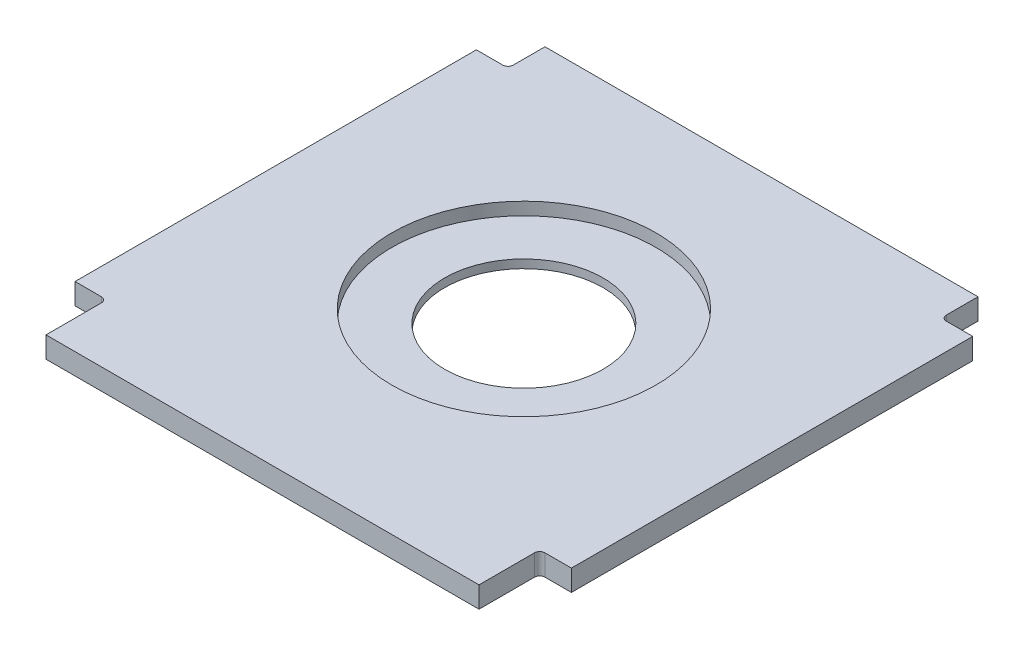
from build123d import *

# Parameters (mm, degrees)
BOSS_EXTRUDE1_DEPTH = 4
CUT_EXTRUDE1_REACH  = 70.376
SKETCH2_R           = 15
FILLET1_R           = 1
SKETCH4_R           = 25
SKETCH4_R_2         = 15
CUT_EXTRUDE2_DEPTH  = 2.4


with BuildPart() as part:
    # Sketch1 → Boss-Extrude1 (new body)
    with BuildSketch(Plane(origin=(0, 0, 0), x_dir=(1, 0, 0), z_dir=(0, 1, 0))):
        Polygon((-41, 38), (-41, 45), (41, 45), (41, 38), (47, 38), (47, -38), (41, -38), (41, -49.5), (-41, -49.5), (-41, -38), (-47, -38), (-47, 38), align=None)
    extrude(amount=BOSS_EXTRUDE1_DEPTH)

    # Sketch2 → Cut-Extrude1 (cut, up to next)
    with BuildSketch(Plane(origin=(0, 4, 0), x_dir=(1, 0, 0), z_dir=(0, 1, 0)), mode=Mode.PRIVATE) as cut_extrude1_sk1:
        with Locations(Location((0, 0, 0), (0, 0, 270))):
            Circle(SKETCH2_R)
    cut_extrude1_tool1 = extrude(cut_extrude1_sk1.sketch, amount=-CUT_EXTRUDE1_REACH, mode=Mode.PRIVATE) & part.part
    add(cut_extrude1_tool1.solids().sort_by_distance((0, 4, 0))[0], mode=Mode.SUBTRACT)

    # Fillet1
    fillet1_edges = [part.edges().sort_by_distance(p)[0] for p in [
        (41, 2, 38),
        (-41, 2, 38),
        (-41, 2, -38),
        (41, 2, -38),
    ]]
    fillet(fillet1_edges, radius=FILLET1_R)

    # Sketch4 → Cut-Extrude2 (cut)
    with BuildSketch(Plane(origin=(0, 4, 0), x_dir=(1, 0, 0), z_dir=(0, 1, 0))):
        with Locations(Location((0, 0, 0), (0, 0, 270))):
            Circle(SKETCH4_R)
        with Locations(Location((0, 0, 0), (0, 0, 270))):
            Circle(SKETCH4_R_2, mode=Mode.SUBTRACT)
    extrude(amount=-CUT_EXTRUDE2_DEPTH, mode=Mode.SUBTRACT)


solid = part.part
